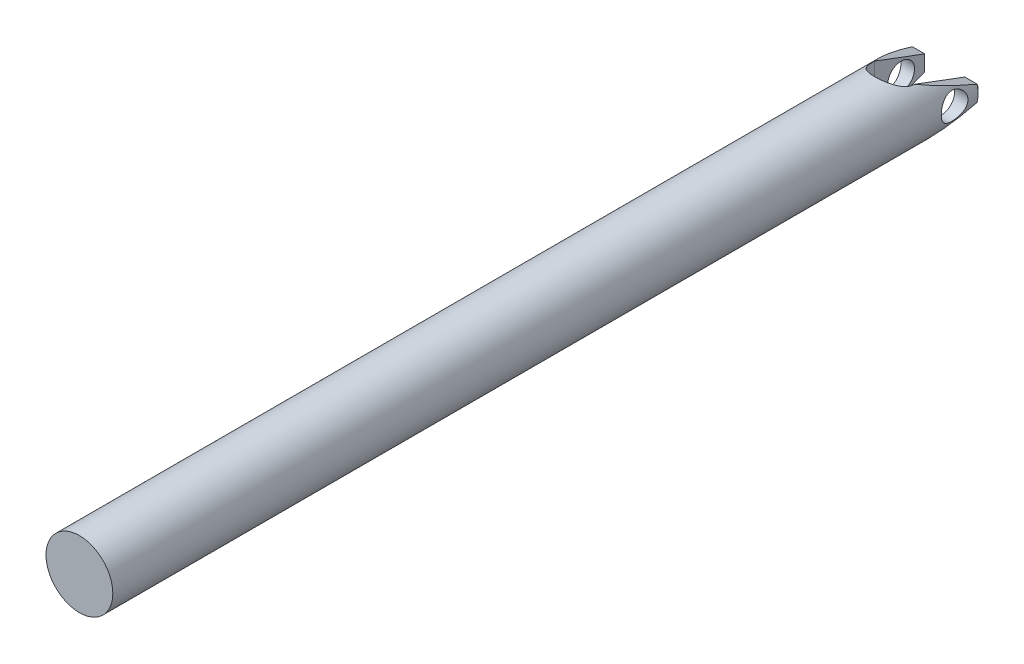
from build123d import *

# Parameters (mm, degrees)
SKETCH1_R           = 5
BOSS_EXTRUDE1_DEPTH = 130
CUT_EXTRUDE1_DEPTH  = 131.479883507
SKETCH3_R           = 2
CUT_EXTRUDE2_DEPTH  = 131.479883618
CHAMFER1_SIZE       = 0.5


with BuildPart() as part:
    # Sketch1 → Boss-Extrude1 (new body)
    with BuildSketch(Plane.XY):
        Circle(SKETCH1_R)
    extrude(amount=BOSS_EXTRUDE1_DEPTH)

    # Sketch2 → Cut-Extrude1 (cut, through all)
    with BuildSketch(Plane(origin=(0, 5, 0), x_dir=(1, 0, 0), z_dir=(0, 1, 0))):
        with BuildLine():
            Line((-3, 0), (3, 0))
            Line((3, 0), (3, -8))
            ThreePointArc((3, -8), (0, -11), (-3, -8))
            Line((-3, -8), (-3, 0))
        make_face()
    extrude(amount=-CUT_EXTRUDE1_DEPTH, mode=Mode.SUBTRACT)

    # Sketch3 → Cut-Extrude2 (cut, through all)
    with BuildSketch(Plane(origin=(5, 0, 0), x_dir=(0, 0, -1), z_dir=(1, 0, 0))):
        with Locations((-4, 0)):
            Circle(SKETCH3_R)
        Polygon((-8, -4), (0, -1), (0, -4), align=None)
        Polygon((0, 1), (0, 4), (-8, 4), align=None)
    extrude(amount=-CUT_EXTRUDE2_DEPTH, mode=Mode.SUBTRACT)

    # Chamfer1
    chamfer1_edges = [part.edges().sort_by_distance(p)[0] for p in [
        (-3.949489743, -1, 0),
        (-5, 0, 0),
        (4.974680765, -0.50254481, 0),
        (-3.949489743, 1, 0),
        (-3, 0, 0),
        (3, 0, 0),
        (3.949489743, -1, 0),
        (3.949489743, 1, 0),
    ]]
    chamfer(chamfer1_edges, length=CHAMFER1_SIZE)


solid = part.part
